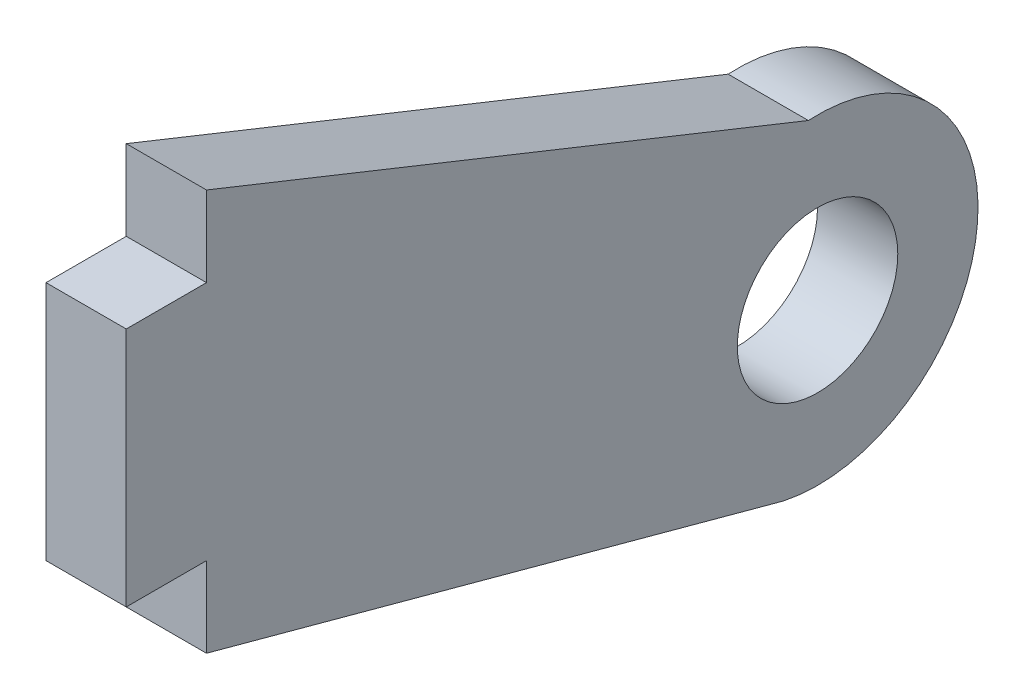
from build123d import *

# Parameters (mm, degrees)
SKETCH1_R           = 2
BOSS_EXTRUDE1_DEPTH = 2


with BuildPart() as part:
    # Sketch1 → Boss-Extrude1 (new body)
    with BuildSketch(Plane(origin=(0, 0, 0), x_dir=(0, 0, -1), z_dir=(1, 0, 0))):
        with BuildLine():
            Line((1, -5), (1, -3))
            Line((1, -3), (-1, -3))
            Line((-1, -3), (-1, 3))
            Line((-1, 3), (1, 3))
            Line((1, 3), (1, 5))
            Line((1, 5), (16, -1))
            ThreePointArc((16, -1), (20.196407848, -5.50210357), (15, -8.8))
            Line((15, -8.8), (1, -5))
        make_face()
        with Locations((16.228881189, -4.993446306)):
            Circle(SKETCH1_R, mode=Mode.SUBTRACT)
    extrude(amount=BOSS_EXTRUDE1_DEPTH)


solid = part.part
